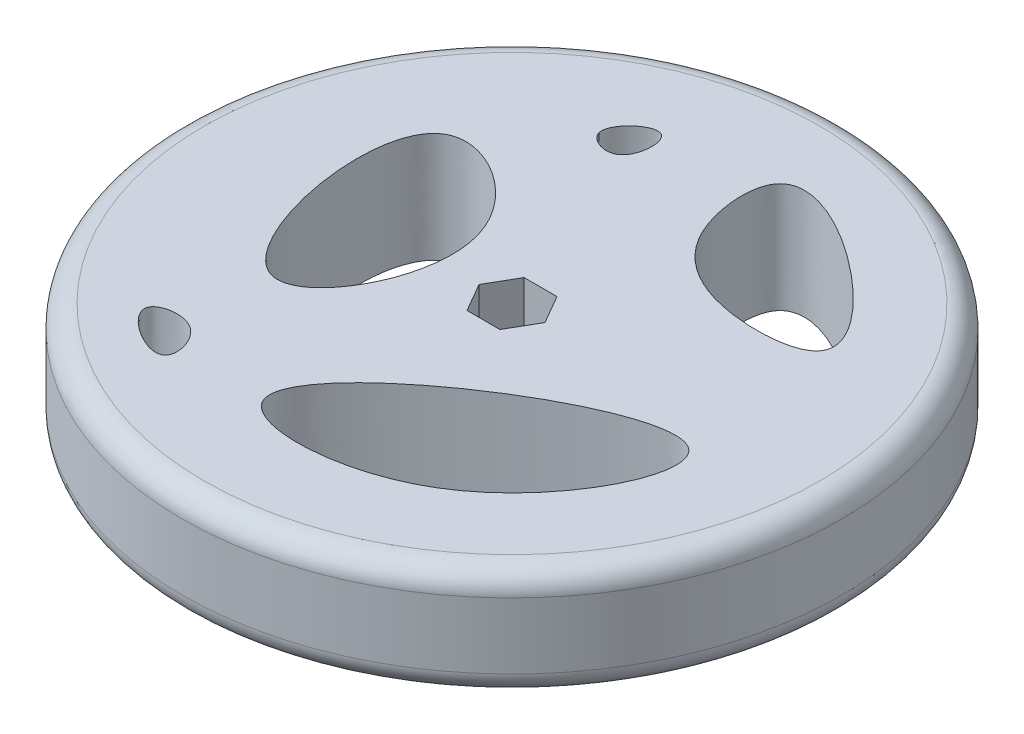
from build123d import *

# Parameters (mm, degrees)
SKETCH1_R           = 30
BOSS_EXTRUDE1_DEPTH = 10
CUT_EXTRUDE1_DEPTH  = 7
FILLET1_R           = 2
CUT_EXTRUDE2_DEPTH  = 10


with BuildPart() as part:
    # Sketch1 → Boss-Extrude1 (new body)
    with BuildSketch(Plane(origin=(0, 0, 0), x_dir=(1, 0, 0), z_dir=(0, 1, 0))):
        with Locations(Location((0, 0, 0), (0, 0, 270))):
            Circle(SKETCH1_R)
    extrude(amount=BOSS_EXTRUDE1_DEPTH)

    # Sketch2 → Cut-Extrude1 (cut)
    with BuildSketch(Plane(origin=(0, 10, 0), x_dir=(1, 0, 0), z_dir=(0, 1, 0))):
        Polygon((1.5, -2.598076211), (3, 0), (1.5, 2.598076211), (-1.5, 2.598076211), (-3, 0), (-1.5, -2.598076211), align=None)
    extrude(amount=-CUT_EXTRUDE1_DEPTH, mode=Mode.SUBTRACT)

    # Fillet1
    fillet1_edges = [part.edges().sort_by_distance(p)[0] for p in [
        (0, 0, -30),
        (0, 10, -30),
    ]]
    fillet(fillet1_edges, radius=FILLET1_R)

    # Sketch3 → Cut-Extrude2 (cut)
    with BuildSketch(Plane(origin=(0, 10, 0), x_dir=(1, 0, 0), z_dir=(0, 1, 0))):
        with BuildLine():
            add(Edge.make_bspline(
                [(-16.307732363, 10.344063247), (-20.858304808, 7.955304571), (-15.247461525, -19.786083503), (-1.86899315, 4.533824594), (-13.679079495, 11.72393741), (-16.307732363, 10.344063247)],
                knots=[0, 0, 0, 0, 0.434023147, 0.749285128, 1, 1, 1, 1], degree=3))
        make_face()
        with BuildLine():
            add(Edge.make_bspline(
                [(11.030149074, -17.996559016), (17.698059776, -14.029116362), (28.801019424, 8.467649404), (-17.246263742, -21.551104151), (5.189314319, -21.471887043), (11.030149074, -17.996559016)],
                knots=[0, 0, 0, 0, 0.282898464, 0.752191766, 1, 1, 1, 1], degree=3))
        make_face()
        with BuildLine():
            add(Edge.make_bspline(
                [(2.533239979, 21.374212321), (4.02417516, 23.543719172), (12.830669115, 19.252417996), (21.358390269, 9.199335639), (8.376874504, 8.478204161), (2.09284829, 13.299227863), (1.70265038, 20.165595174), (2.533239979, 21.374212321)],
                knots=[0, 0, 0, 0, 0.242585442, 0.460385525, 0.640847003, 0.864857341, 1, 1, 1, 1], degree=3))
        make_face()
        with BuildLine():
            add(Edge.make_bspline(
                [(-9.49964992, 17.416024854), (-9.259580028, 16.581152381), (-5.943848627, 15.329968774), (-5.514059513, 22.474247598), (-9.863213937, 18.680363277), (-9.49964992, 17.416024854)],
                knots=[0, 0, 0, 0, 0.256133798, 0.61210866, 1, 1, 1, 1], degree=3))
        make_face()
        with BuildLine():
            add(Edge.make_bspline(
                [(-16.307732363, -16.941042358), (-16.673577152, -18.279118788), (-10.275872625, -22.410169383), (-12.085929557, -15.292292342), (-16.073806381, -16.085458646), (-16.307732363, -16.941042358)],
                knots=[0, 0, 0, 0, 0.433835951, 0.722599573, 1, 1, 1, 1], degree=3))
        make_face()
    extrude(amount=-CUT_EXTRUDE2_DEPTH, mode=Mode.SUBTRACT)


solid = part.part
